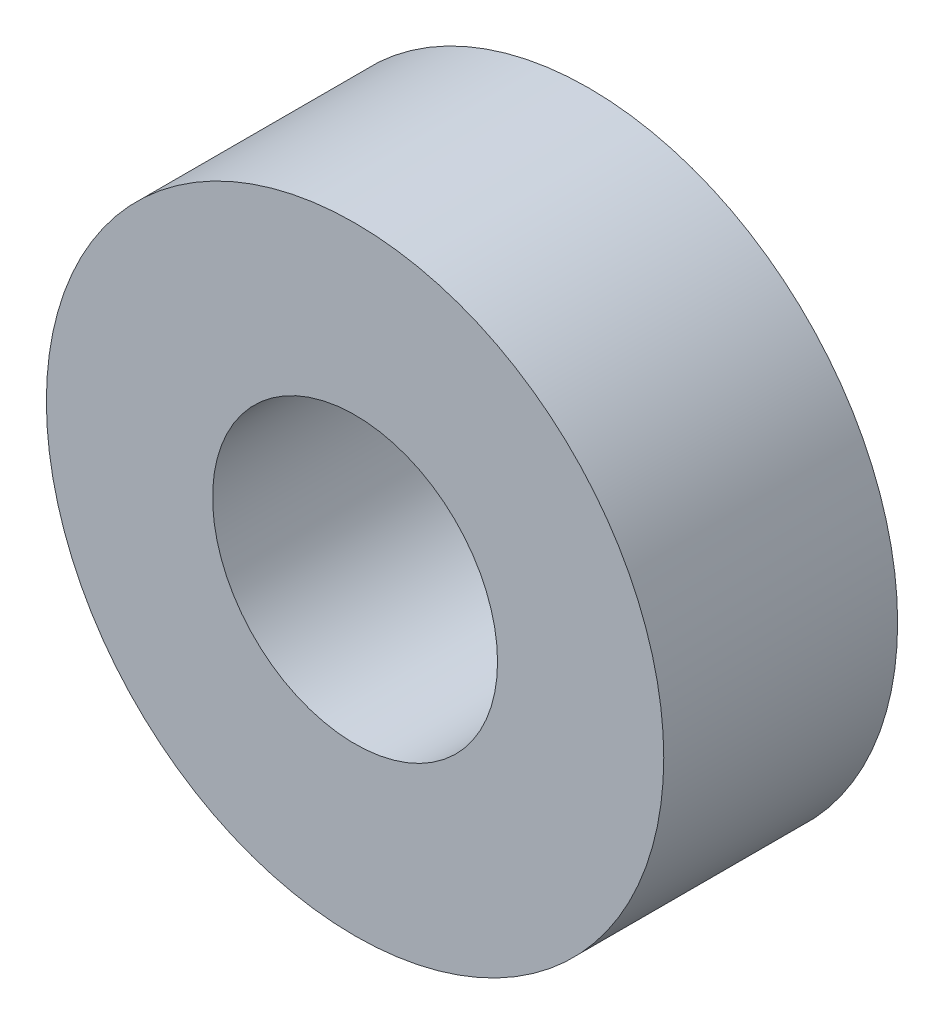
from build123d import *

# Parameters (mm, degrees)
SKETCH1_R           = 6.6
SKETCH1_R_2         = 3.046153846
BOSS_EXTRUDE1_DEPTH = 5


with BuildPart() as part:
    # Sketch1 → Boss-Extrude1 (new body)
    with BuildSketch(Plane.XY):
        Circle(SKETCH1_R)
        Circle(SKETCH1_R_2, mode=Mode.SUBTRACT)
    extrude(amount=BOSS_EXTRUDE1_DEPTH)


solid = part.part
